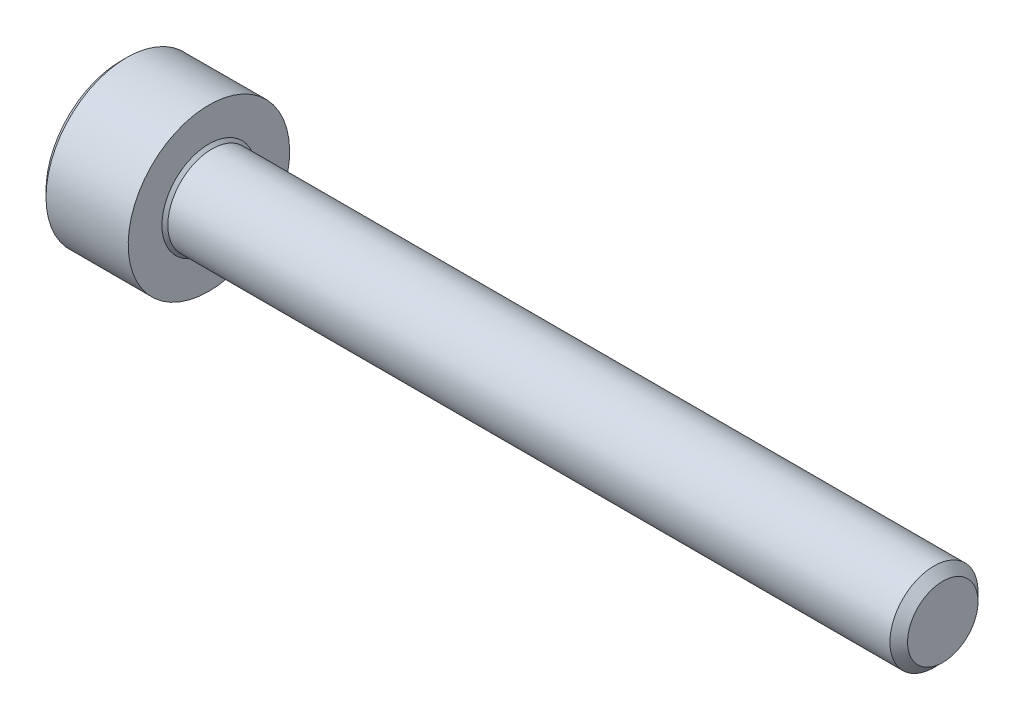
from build123d import *

# Parameters (mm, degrees)
SKETCH2_R           = 1.5
BOSS_EXTRUDE1_DEPTH = 25
CHAMFER1_SIZE       = 0.3
SKETCH6_W           = 3
SKETCH6_H           = 2.75
CUT_EXTRUDE1_DEPTH  = 1.6
SKETCH8_R           = 1.493375673
CUT_EXTRUDE2_DEPTH  = 1
CUT_EXTRUDE2_DRAFT  = -45
CHAMFER2_SIZE       = 0.2
CHAMFER3_SIZE       = 0.1


with BuildPart() as part:
    # Sketch2 → Boss-Extrude1 (new body)
    with BuildSketch(Plane(origin=(0, 0, 0), x_dir=(0, 0, -1), z_dir=(1, 0, 0))):
        Circle(SKETCH2_R)
    extrude(amount=-BOSS_EXTRUDE1_DEPTH)

    # Chamfer1
    chamfer1_edges = [part.edges().sort_by_distance(p)[0] for p in [
        (0, 0, 1.5),
    ]]
    chamfer(chamfer1_edges, length=CHAMFER1_SIZE)

    # Sketch6 → Revolve1 (revolve)
    with BuildSketch(Plane.XY, mode=Mode.PRIVATE) as revolve1_sk:
        with Locations((-26.5, 1.375)):
            Rectangle(SKETCH6_W, SKETCH6_H)
    revolve(revolve1_sk.sketch.rotate(Axis((-25, 0, 0), (1, 0, 0)), 180), axis=Axis((-25, 0, 0), (1, 0, 0)))

    # Sketch7 → Cut-Extrude1 (cut)
    with BuildSketch(Plane.ZY.offset(28)):
        Polygon((0, 1.443375673), (-1.25, 0.721687836), (-1.25, -0.721687836), (0, -1.443375673), (1.25, -0.721687836), (1.25, 0.721687836), align=None)
    extrude(amount=-CUT_EXTRUDE1_DEPTH, mode=Mode.SUBTRACT)


with BuildPart() as cut_extrude2_tool:
    # Sketch8 → Cut-Extrude2 (with draft: the straight prism first)
    with BuildSketch(Plane.ZY.offset(28)):
        Circle(SKETCH8_R)
    extrude(amount=-CUT_EXTRUDE2_DEPTH)
    # Cut-Extrude2: the draft: its side faces are tilted about the plane it starts from
    cut_extrude2_sides = [cut_extrude2_tool.faces().sort_by_distance(p)[0] for p in [
        (-27.5, 0, -1.493375673),
    ]]
    draft(cut_extrude2_sides, Plane.ZY.offset(28), CUT_EXTRUDE2_DRAFT)


with BuildPart() as part_1:
    add(part.part)

    # Cut-Extrude2: cut by cut_extrude2_tool
    add(cut_extrude2_tool.part, mode=Mode.SUBTRACT)

    # Chamfer2
    chamfer2_edges = [part_1.edges().sort_by_distance(p)[0] for p in [
        (-28, 2.75, 0),
    ]]
    chamfer(chamfer2_edges, length=CHAMFER2_SIZE)

    # Chamfer3
    chamfer3_edges = [part_1.edges().sort_by_distance(p)[0] for p in [
        (-25, 0, 1.5),
    ]]
    chamfer(chamfer3_edges, length=CHAMFER3_SIZE)


solid = part_1.part
